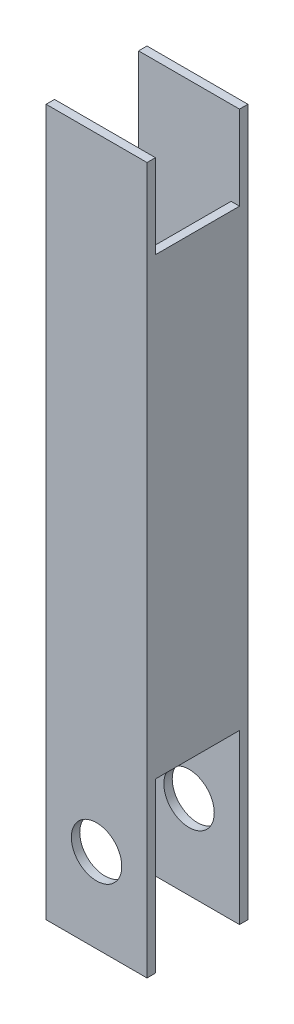
from build123d import *

# Parameters (mm, degrees)
SKETCH2_W               = 60
SKETCH2_H               = 60
BOSS_EXTRUDE1_DEPTH     = 420
SHELL1_T                = -5
SKETCH3_W               = 100
SKETCH3_H               = 50
SKETCH3_W_2             = 50
CUT_EXTRUDE1_DEPTH      = 426.323406363
CUT_EXTRUDE3_DEPTH      = 425.646912152
CUT_EXTRUDE3_DEPTH_BACK = 425.646912152
SKETCH4_R               = 15


with BuildPart() as part:
    # Sketch2 → Boss-Extrude1 (new body)
    with BuildSketch(Plane(origin=(0, 0, 0), x_dir=(-1, 0, 0), z_dir=(0, 1, 0))):
        Rectangle(SKETCH2_W, SKETCH2_H)
    extrude(amount=BOSS_EXTRUDE1_DEPTH)

    # Shell1
    shell1_openings = [part.faces().sort_by_distance(p)[0] for p in [
        (0, 0, 0),
        (0, 420, 0),
    ]]
    offset(amount=SHELL1_T, openings=shell1_openings, kind=Kind.INTERSECTION)

    # Sketch3 → Cut-Extrude1 (cut, through all)
    with BuildSketch(Plane.YZ.offset(30)):
        with Locations((50, 0)):
            Rectangle(SKETCH3_W, SKETCH3_H)
        with Locations((395, 0)):
            Rectangle(SKETCH3_W_2, SKETCH3_H)
    extrude(amount=-CUT_EXTRUDE1_DEPTH, mode=Mode.SUBTRACT)

    # Sketch4 → Cut-Extrude3 (cut, two sides: drawn at the far end of the back side and taken through both)
    with BuildSketch(Plane(origin=(0, 0, 25), x_dir=(1, 0, 0), z_dir=(0, 0, -1)).offset(-CUT_EXTRUDE3_DEPTH_BACK)):
        with Locations((0, -50)):
            Circle(SKETCH4_R)
    extrude(amount=CUT_EXTRUDE3_DEPTH + CUT_EXTRUDE3_DEPTH_BACK, mode=Mode.SUBTRACT)


solid = part.part
